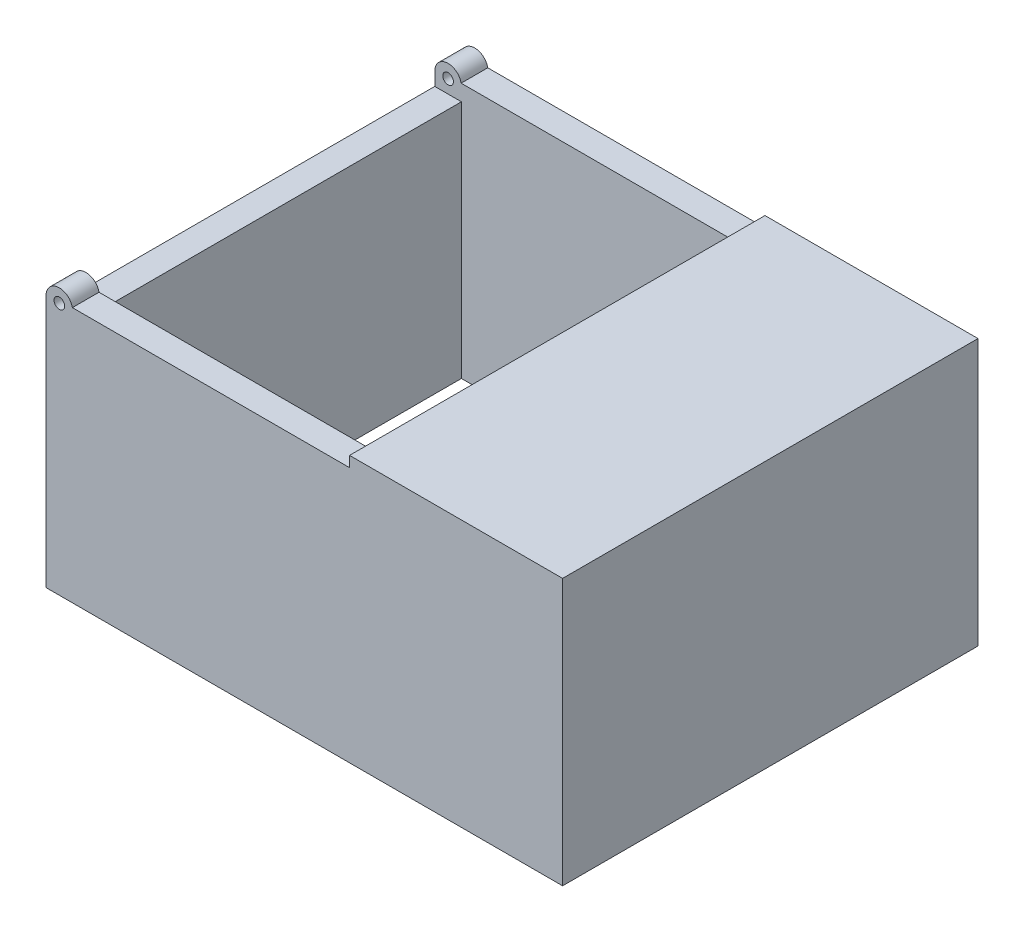
from build123d import *

# Parameters (mm, degrees)
SKETCH1_W               = 80
SKETCH1_H               = 5
BOSS_EXTRUDE1_DEPTH     = 156
SKETCH2_W               = 174
SKETCH2_H               = 136
CUT_EXTRUDE1_DEPTH      = 96
SKETCH3_W               = 94
SKETCH3_H               = 136
CUT_EXTRUDE2_DEPTH      = 96
SKETCH6_W               = 10
SKETCH6_H               = 5
CUT_EXTRUDE3_DEPTH      = 136
CUT_EXTRUDE4_DEPTH      = 183.277261336
CUT_EXTRUDE4_DEPTH_BACK = 183.277261336
SKETCH7_W               = 114
SKETCH7_H               = 4
CUT_EXTRUDE9_REACH      = 192.381
BOSS_EXTRUDE2_DEPTH     = 10
SKETCH10_R              = 2
CUT_EXTRUDE10_DEPTH     = 96
SKETCH12_R              = 2
CUT_EXTRUDE11_DEPTH     = 60


with BuildPart() as part:
    # Sketch1 → Boss-Extrude1 (new body)
    with BuildSketch(Plane.XY):
        Polygon((-97, 50), (-97, -50), (97, -50), (97, 45), (17, 45), (17, 50), align=None)
        with Locations((57, 47.5)):
            Rectangle(SKETCH1_W, SKETCH1_H)
    extrude(amount=BOSS_EXTRUDE1_DEPTH)

    # Sketch2 → Cut-Extrude1 (cut)
    with BuildSketch(Plane(origin=(0, -50, 0), x_dir=(-1, 0, 0), z_dir=(0, -1, 0))):
        with Locations((0, -78)):
            Rectangle(SKETCH2_W, SKETCH2_H)
    extrude(amount=-CUT_EXTRUDE1_DEPTH, mode=Mode.SUBTRACT)

    # Sketch3 → Cut-Extrude2 (cut)
    with BuildSketch(Plane(origin=(0, 50, 0), x_dir=(1, 0, 0), z_dir=(0, 1, 0))):
        with Locations((-40, -78)):
            Rectangle(SKETCH3_W, SKETCH3_H)
    extrude(amount=-CUT_EXTRUDE2_DEPTH, mode=Mode.SUBTRACT)

    # Sketch6 → Cut-Extrude3 (cut)
    with BuildSketch(Plane.XY.offset(10)):
        with Locations((12, 47.5)):
            Rectangle(SKETCH6_W, SKETCH6_H)
    extrude(amount=CUT_EXTRUDE3_DEPTH, mode=Mode.SUBTRACT)

    # Sketch7 → Cut-Extrude4 (cut, two sides: drawn at the far end of the back side and taken through both)
    with BuildSketch(Plane.XY.offset(10).offset(-CUT_EXTRUDE4_DEPTH_BACK)):
        with Locations((-40, 48)):
            Rectangle(SKETCH7_W, SKETCH7_H)
    extrude(amount=CUT_EXTRUDE4_DEPTH + CUT_EXTRUDE4_DEPTH_BACK, mode=Mode.SUBTRACT)

    # Cut-Extrude9: up to this face of the body (flat: up to its plane)
    cut_extrude9_end = Plane(part.part.faces().sort_by_distance((0.962837838, -1.155405405, 156))[0])
    # Sketch8 → Cut-Extrude9 (cut, up to the picked face)
    with BuildSketch(Plane.XY, mode=Mode.PRIVATE) as cut_extrude9_sk1:
        Polygon((-97, 46), (-97, 45), (-97, 40), (-92, 40), (-87, 40), (-87, 46), align=None)
    cut_extrude9_tool1 = split(extrude(cut_extrude9_sk1.sketch, amount=CUT_EXTRUDE9_REACH, mode=Mode.PRIVATE), bisect_by=cut_extrude9_end, keep=Keep.BOTH, mode=Mode.PRIVATE)
    add(cut_extrude9_tool1.solids().sort_by(Axis((-92, 43, 0), (0, 0, 1)))[0], mode=Mode.SUBTRACT)

    # Sketch9 → Boss-Extrude2 (add)
    with BuildSketch(Plane.XY.offset(156)):
        with BuildLine():
            Line((-97, 40), (-97, 45))
            ThreePointArc((-97, 45), (-92.50254481, 49.974680765), (-87.101020514, 46))
            Line((-87.101020514, 46), (-87, 46))
            Line((-87, 46), (-87, 45))
            Line((-87, 45), (-87, 40))
            Line((-87, 40), (-97, 40))
        make_face()
    boss_extrude2 = extrude(amount=-BOSS_EXTRUDE2_DEPTH)

    # Sketch10 → Cut-Extrude10 (cut)
    with BuildSketch(Plane(origin=(0, 0, 146), x_dir=(-1, 0, 0), z_dir=(0, 0, -1))):
        with Locations((92, 45)):
            Circle(SKETCH10_R)
    cut_extrude10 = extrude(amount=-CUT_EXTRUDE10_DEPTH, mode=Mode.SUBTRACT)

    # Mirror1: Boss-Extrude2, Cut-Extrude10 across plane
    add(boss_extrude2.mirror(Plane.XY.offset(78)))
    add(cut_extrude10.mirror(Plane.XY.offset(78)), mode=Mode.SUBTRACT)

    # Sketch12 → Cut-Extrude11 (cut)
    with BuildSketch(Plane(origin=(0, -50, 0), x_dir=(-1, 0, 0), z_dir=(0, -1, 0))):
        with Locations(Location((92, -151, 0), (0, 0, 90))):
            Circle(SKETCH12_R)
        with Locations(Location((-92, -151, 0), (0, 0, 90))):
            Circle(SKETCH12_R)
        with Locations(Location((-92, -5, 0), (0, 0, 90))):
            Circle(SKETCH12_R)
        with Locations(Location((92, -5, 0), (0, 0, 90))):
            Circle(SKETCH12_R)
    extrude(amount=-CUT_EXTRUDE11_DEPTH, mode=Mode.SUBTRACT)


solid = part.part
